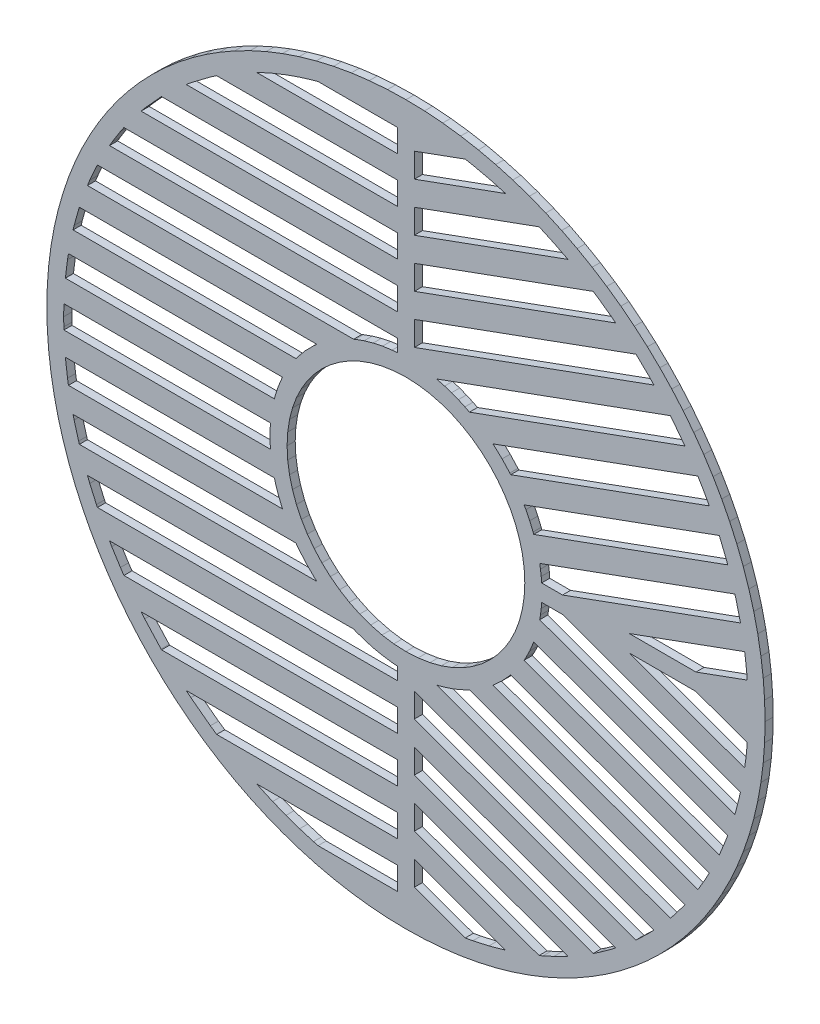
from build123d import *

# Parameters (mm, degrees)
BOSS_EXTRUDE1_DEPTH = 3


with BuildPart() as part:
    # Model → Boss-Extrude1 (new body)
    with BuildSketch(Plane.XY):
        Polygon((143.127891541, 219.126633369), (149.984923469, 218.953249161), (156.751941511, 218.438678079), (163.42056978, 217.591292585), (169.982432387, 216.419464719), (176.429164208, 214.931567174), (182.752400123, 213.135972304), (188.94374271, 211.04105213), (194.994837613, 208.655179511), (200.897319709, 205.986725627), (206.64281311, 203.04406502), (212.222920397, 199.835568195), (217.629287211, 196.369608349), (222.853559197, 192.654557334), (227.887338935, 188.698785655), (232.722250536, 184.5106692), (237.349939643, 180.098578474), (241.762030368, 175.470889367), (245.950146823, 170.635967), (249.905934652, 165.602187263), (253.620974901, 160.377926042), (257.086934747, 154.971553845), (260.2954383, 149.391435793), (263.238088142, 143.645953157), (265.906551446, 137.743476444), (268.292430793, 131.692376158), (270.387350294, 125.501028188), (272.182934062, 119.17780304), (273.670827738, 112.731071218), (274.842655436, 106.169197845), (275.690041267, 99.500569577), (276.204630873, 92.733551534), (276.378005303, 85.876519606), (276.204630873, 79.019487678), (275.690041267, 72.252469635), (274.842655436, 65.583841366), (273.670827738, 59.02197876), (272.182934062, 52.575246938), (270.387350294, 46.252011024), (268.292430793, 40.060668437), (265.906551446, 34.009573534), (263.238088142, 28.107091437), (260.2954383, 22.361598036), (257.086934747, 16.78149075), (253.620974901, 11.375123935), (249.905934652, 6.150851949), (245.950146823, 1.117072211), (241.762030368, -3.717839389), (237.349939643, -8.345528497), (232.722250536, -12.757619222), (227.887338935, -16.945735677), (222.853559197, -20.901523505), (217.629287211, -24.616563755), (212.222920397, -28.0825236), (206.64281311, -31.291027154), (200.897319709, -34.233676995), (194.994837613, -36.902140299), (188.94374271, -39.288019647), (182.752400123, -41.382939148), (176.429164208, -43.178522915), (169.982432387, -44.666416592), (163.42056978, -45.83824429), (156.751941511, -46.68563012), (149.984923469, -47.200219727), (143.127891541, -47.373594157), (136.270859612, -47.200219727), (129.50384157, -46.68563012), (122.835213301, -45.83824429), (116.273339929, -44.666416592), (109.826608107, -43.178522915), (103.503382958, -41.382939148), (97.312034988, -39.288019647), (91.260934703, -36.902140299), (85.358457989, -34.233676995), (79.612975354, -31.291027154), (74.032857302, -28.0825236), (68.626485104, -24.616563755), (63.402223884, -20.901523505), (58.368444146, -16.945735677), (53.533521779, -12.757619222), (48.905832672, -8.345528497), (44.493741947, -3.717839389), (40.305625492, 1.117072211), (36.349853812, 6.150851949), (32.634802797, 11.375123935), (29.168842951, 16.78149075), (25.960346127, 22.361598036), (23.017685519, 28.107091437), (20.349231635, 34.009573534), (17.963359017, 40.060668437), (15.868438843, 46.252011024), (14.072843973, 52.575246938), (12.584946427, 59.02197876), (11.413118561, 65.583841366), (10.565733067, 72.252469635), (10.051161986, 79.019487678), (9.877777778, 85.876519606), (10.051161986, 92.733551534), (10.565733067, 99.500569577), (11.413118561, 106.169197845), (12.584946427, 112.731071218), (14.072843973, 119.17780304), (15.868438843, 125.501028188), (17.963359017, 131.692376158), (20.349231635, 137.743476444), (23.017685519, 143.645953157), (25.960346127, 149.391435793), (29.168842951, 154.971553845), (32.634802797, 160.377926042), (36.349853812, 165.602187263), (40.305625492, 170.635967), (44.493741947, 175.470889367), (48.905832672, 180.098578474), (53.533521779, 184.5106692), (58.368444146, 188.698785655), (63.402223884, 192.654557334), (68.626485104, 196.369608349), (74.032857302, 199.835568195), (79.612975354, 203.04406502), (85.358457989, 205.986725627), (91.260934703, 208.655179511), (97.312034988, 211.04105213), (103.503382958, 213.135972304), (109.826608107, 214.931567174), (116.273339929, 216.419464719), (122.835213301, 217.591292585), (129.50384157, 218.438678079), (136.270859612, 218.953249161), align=None)
        Polygon((87.723182297, -28.423480394), (88.806799401, -28.95299157), (93.660330666, -31.12915073), (98.618991174, -33.105558946), (103.677672492, -34.877070109), (108.831276957, -36.438602702), (110.524724409, -36.890147061), (140.002888489, -36.890147061), (140.002888489, -28.423480394), align=None, mode=Mode.SUBTRACT)
        Polygon((146.252894592, -23.3813463), (146.252894592, -32.391390652), (165.126290385, -39.260738797), (167.94760827, -38.73798862), (173.928347863, -37.403057183), (179.79900589, -35.791053942), (180.093938361, -35.698488532), align=None, mode=Mode.SUBTRACT)
        Polygon((61.593435711, -11.490147061), (63.34052976, -12.93691491), (70.545893139, -18.352583483), (72.904222488, -19.956813727), (140.002888489, -19.956813727), (140.002888489, -11.490147061), align=None, mode=Mode.SUBTRACT)
        Polygon((146.252894592, -5.361279127), (146.252894592, -14.37132348), (192.504765659, -31.205610318), (193.946365865, -30.596538968), (198.030591159, -28.726325819), (202.035557726, -26.717619832), (203.201808675, -26.088997565), align=None, mode=Mode.SUBTRACT)
        Polygon((44.849695672, 5.443186273), (46.198248694, 3.813462321), (52.254390123, -2.842397563), (52.439695888, -3.023480394), (140.002888489, -3.023480394), (140.002888489, 5.443186273), align=None, mode=Mode.SUBTRACT)
        Polygon((146.252894592, 12.658788045), (146.252894592, 3.648743693), (212.610321384, -20.503378126), (214.77349684, -19.061002774), (219.587091912, -15.602449883), (220.968015374, -14.535288493), align=None, mode=Mode.SUBTRACT)
        Polygon((33.128347715, 22.376519606), (33.970735465, 20.924885559), (37.179696571, 15.822720676), (38.479856767, 13.909852939), (140.002888489, 13.909852939), (140.002888489, 22.376519606), align=None, mode=Mode.SUBTRACT)
        Polygon((146.252894592, 30.67887675), (146.252894592, 21.668832397), (228.456684028, -8.25089603), (228.69163954, -8.046494208), (232.968058099, -3.963646952), (235.150870599, -1.677330865), align=None, mode=Mode.SUBTRACT)
        Polygon((24.943714597, 39.309852939), (25.8089436, 37.155677795), (28.277747472, 31.598975627), (28.646709124, 30.843186273), (140.002888489, 30.843186273), (140.002888489, 35.535169474), (137.969959174, 35.689746602), (134.430995602, 36.176151021), (130.974509769, 36.902915446), (127.6093082, 37.861211819), (124.344218953, 39.042255147), (123.719526249, 39.309852939), align=None, mode=Mode.SUBTRACT)
        Polygon((166.686358812, 41.261779446), (164.998843384, 40.403939904), (162.55179206, 39.304416148), (160.037787459, 38.333232964), (157.46097446, 37.494524468), (154.825487179, 36.79243554), (154.438710615, 36.709516398), (241.216262648, 5.125074768), (242.796355693, 7.074482049), (246.363515218, 11.803090922), (246.619615004, 12.168443298), align=None, mode=Mode.SUBTRACT)
        Polygon((181.984208425, 53.71389406), (181.667151981, 53.322606574), (178.799465264, 50.204945882), (175.681804572, 47.337259165), (175.392674934, 47.102981906), (251.432305739, 19.426807319), (252.833598328, 21.757543606), (254.30745324, 24.344444275), (255.67995775, 26.89084354), align=None, mode=Mode.SUBTRACT)
        Polygon((19.613246197, 56.243186273), (20.004628558, 54.613107045), (21.664772299, 48.67034963), (21.950191731, 47.776519606), (110.079252031, 47.776519606), (108.984960514, 48.738799371), (105.785941739, 51.956949192), (102.885031382, 55.450911204), (102.312639533, 56.243186273), align=None, mode=Mode.SUBTRACT)
        Polygon((190.536001248, 68.62137129), (190.298375787, 67.953248851), (189.055417633, 64.976083459), (187.631236691, 62.098922729), (186.962920464, 60.911828952), (259.374693468, 34.556094869), (259.600950114, 35.058045281), (261.873851861, 40.621723768), (262.533221605, 42.416532389), align=None, mode=Mode.SUBTRACT)
        Polygon((16.755883328, 73.176519606), (16.763301722, 73.091662598), (17.54628378, 66.831364271), (17.892211739, 64.709852939), (97.333868281, 64.709852939), (97.074065018, 65.255426873), (95.768363063, 68.45866589), (94.680299632, 71.767098745), (94.30599539, 73.176519606), align=None, mode=Mode.SUBTRACT)
        Polygon((225.978389994, 82.751516554), (268.796620517, 67.166948869), (269.209429084, 70.218442196), (269.55204383, 73.319501834), (269.766867065, 75.823849403), (250.733274333, 82.751516554), align=None, mode=Mode.SUBTRACT)
        Polygon((193.469241672, 82.751516554), (193.314664544, 80.71858724), (193.040736389, 78.507352702), (192.756322225, 76.823282369), (265.159396362, 50.470713467), (265.63563775, 52.126523251), (267.110030958, 58.053131782), (267.250354004, 58.719703929), (201.223505656, 82.751516554), align=None, mode=Mode.SUBTRACT)
        Polygon((16.205623526, 90.109852939), (16.167980475, 89.103379059), (16.127784554, 85.87650884), (16.167980475, 82.649638621), (16.205623526, 81.643186273), (92.866591432, 81.643186273), (92.738385434, 83.441795264), (92.680663935, 85.876519606), (92.738385434, 88.311243947), (92.866591432, 90.109852939), align=None, mode=Mode.SUBTRACT)
        Polygon((268.796620517, 104.586079576), (225.978389994, 89.001522658), (250.733252801, 89.001522658), (269.766867065, 95.929189809), (269.55204383, 98.433537377), (269.209429084, 101.534597015), align=None, mode=Mode.SUBTRACT)
        Polygon((17.892211739, 107.043186273), (17.54628378, 104.921653408), (16.763301722, 98.661365848), (16.755887365, 98.576519606), (94.305990007, 98.576519606), (94.680299632, 99.985951233), (95.768363063, 103.294384087), (97.074065018, 106.497623105), (97.333862898, 107.043186273), align=None, mode=Mode.SUBTRACT)
        Polygon((265.159396362, 121.282325745), (192.756322225, 94.929756843), (193.040736389, 93.245697276), (193.314664544, 91.034462738), (193.469241672, 89.001522658), (201.223505656, 89.001522658), (267.250354004, 113.033335283), (267.110030958, 113.699918196), (265.63563775, 119.626526727), align=None, mode=Mode.SUBTRACT)
        Polygon((21.950195768, 123.976519606), (21.664772299, 123.082678816), (20.004628558, 117.139932166), (19.613250234, 115.509852939), (102.312639533, 115.509852939), (102.885031382, 116.302128008), (105.785941739, 119.796100786), (108.984960514, 123.014250607), (110.079241265, 123.976519606), align=None, mode=Mode.SUBTRACT)
        Polygon((143.127891541, 129.973747211), (138.61920895, 129.746080229), (134.240761736, 129.07785013), (130.014727698, 127.991218567), (125.963263109, 126.508374108), (122.108535004, 124.651446109), (118.472710419, 122.442633904), (115.07795639, 119.904082998), (111.946439955, 117.057971191), (109.100328149, 113.926454756), (106.561777242, 110.531700728), (104.352965037, 106.895876143), (102.496037038, 103.041148037), (101.013192579, 98.989683448), (99.926561017, 94.763649411), (99.258330917, 90.385202196), (99.030663935, 85.876519606), (99.258330917, 81.367837016), (99.926561017, 76.989389801), (101.013192579, 72.763355764), (102.496037038, 68.711891174), (104.352965037, 64.857163069), (106.561777242, 61.22134925), (109.100328149, 57.826595222), (111.946439955, 54.695078786), (115.07795639, 51.848956214), (118.472710419, 49.310416073), (122.108535004, 47.101593102), (125.963263109, 45.244675869), (130.014727698, 43.761820645), (134.240761736, 42.675194465), (138.61920895, 42.006964366), (143.127891541, 41.779297384), (147.636574131, 42.006964366), (152.015021345, 42.675194465), (156.241055383, 43.761820645), (160.292519972, 45.244675869), (164.147248077, 47.101593102), (167.783061896, 49.310416073), (171.177815925, 51.848956214), (174.30933236, 54.695078786), (177.155454932, 57.826595222), (179.693995073, 61.22134925), (181.902818044, 64.857163069), (183.759735277, 68.711891174), (185.242590502, 72.763355764), (186.329216682, 76.989389801), (186.997446781, 81.367837016), (187.225113763, 85.876519606), (186.997446781, 90.385202196), (186.329216682, 94.763649411), (185.242590502, 98.989683448), (183.759735277, 103.041148037), (181.902818044, 106.895876143), (179.693995073, 110.531700728), (177.155454932, 113.926454756), (174.30933236, 117.057971191), (171.177815925, 119.904082998), (167.783061896, 122.442633904), (164.147248077, 124.651446109), (160.292519972, 126.508374108), (156.241055383, 127.991218567), (152.015021345, 129.07785013), (147.636574131, 129.746080229), align=None, mode=Mode.SUBTRACT)
        Polygon((259.374693468, 137.196944343), (186.96293123, 110.841210259), (187.631236691, 109.654127248), (189.055417633, 106.776966519), (190.298375787, 103.799801127), (190.536001248, 103.131667921), (262.533221605, 129.336512205), (261.873851861, 131.131326209), (259.600950114, 136.694999313), align=None, mode=Mode.SUBTRACT)
        Polygon((28.646715853, 140.909858322), (28.277747472, 140.154068968), (25.8089436, 134.597361416), (24.943718635, 132.443191655), (123.719515483, 132.443191655), (124.344218953, 132.710789447), (127.6093082, 133.89182201), (130.974509769, 134.850123766), (134.430995602, 135.57688819), (137.969959174, 136.063297992), (140.002888489, 136.217880503), (140.002888489, 140.909858322), align=None, mode=Mode.SUBTRACT)
        Polygon((251.432305739, 152.326221127), (175.392696465, 124.650057305), (175.681804572, 124.415790812), (178.799465264, 121.548104095), (181.667151981, 118.430443403), (181.984219191, 118.039145152), (255.679979282, 144.862206438), (254.30745324, 147.40860032), (252.833598328, 149.995506371), align=None, mode=Mode.SUBTRACT)
        Polygon((38.479859458, 157.843191655), (37.179696571, 155.930313153), (33.970735465, 150.828159036), (33.128355789, 149.376524989), (140.002888489, 149.376524989), (140.002888489, 157.843191655), align=None, mode=Mode.SUBTRACT)
        Polygon((241.216262648, 166.627964444), (154.438710615, 135.043517431), (154.825487179, 134.960592906), (157.46097446, 134.258520126), (160.037787459, 133.419817013), (162.55179206, 132.448628447), (164.998843384, 131.349104691), (166.686358812, 130.491259766), (246.619636536, 159.58459053), (246.363515218, 159.949953673), (242.796355693, 164.678557163), align=None, mode=Mode.SUBTRACT)
        Polygon((52.439701271, 174.776524989), (52.254390123, 174.595450232), (46.198248694, 167.939582274), (44.849701055, 166.309858322), (140.002888489, 166.309858322), (140.002888489, 174.776524989), align=None, mode=Mode.SUBTRACT)
        Polygon((228.456662496, 180.003935242), (146.252894592, 150.084206814), (146.252894592, 141.074167845), (235.150870599, 173.430386225), (232.968058099, 175.71669693), (228.69163954, 179.799549569), align=None, mode=Mode.SUBTRACT)
        Polygon((72.904222488, 191.709861014), (70.545893139, 190.10563346), (63.34052976, 184.689956813), (61.593435711, 183.243188964), (140.002888489, 183.243188964), (140.002888489, 191.709861014), align=None, mode=Mode.SUBTRACT)
        Polygon((212.610321384, 192.25642003), (146.252894592, 168.104284753), (146.252894592, 159.094245783), (220.968015374, 186.288330396), (219.587091912, 187.355489095), (214.77349684, 190.814058134), align=None, mode=Mode.SUBTRACT)
        Polygon((192.504765659, 202.958662987), (146.252894592, 186.124357308), (146.252894592, 177.114318339), (203.201808675, 197.842034086), (202.035557726, 198.470657698), (198.030591159, 200.479366377), (193.946365865, 202.349586254), align=None, mode=Mode.SUBTRACT)
        Polygon((110.524745941, 208.643188291), (108.831276957, 208.191643259), (103.677672492, 206.630103938), (98.618991174, 204.858590084), (93.660330666, 202.882203399), (88.806799401, 200.706041548), (87.72318768, 200.176522297), (140.002888489, 200.176522297), (140.002888489, 208.643188291), align=None, mode=Mode.SUBTRACT)
        Polygon((165.126268853, 211.013786083), (146.252894592, 204.14444063), (146.252894592, 195.134398969), (180.093927595, 207.451526398), (179.79900589, 207.544093153), (173.928347863, 209.156095722), (167.94760827, 210.491033888), align=None, mode=Mode.SUBTRACT)
    extrude(amount=BOSS_EXTRUDE1_DEPTH)


solid = part.part
